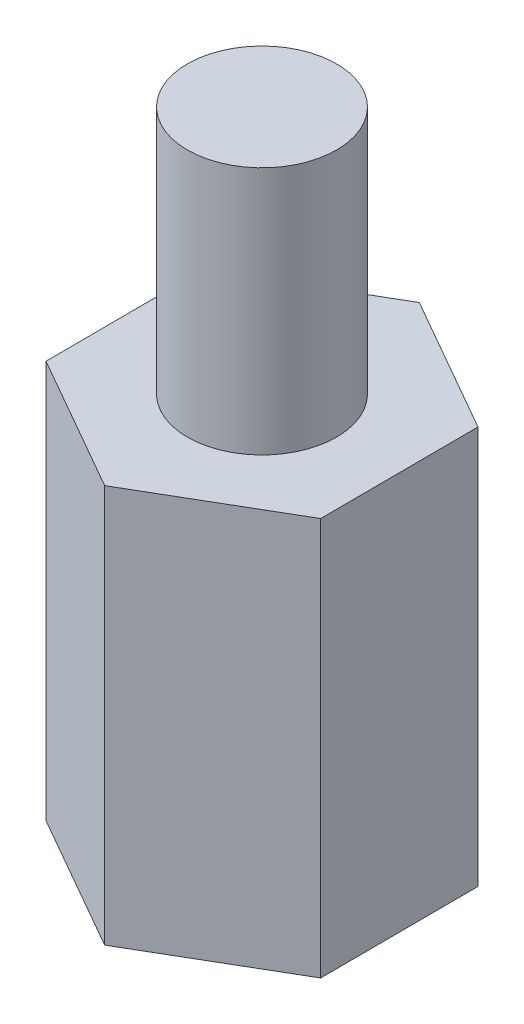
from build123d import *

# Parameters (mm, degrees)
SALIENTE_EXTRUIR1_DEPTH = 8
CROQUIS2_R              = 1.5
SALIENTE_EXTRUIR2_DEPTH = 5


with BuildPart() as part:
    # Croquis1 → Saliente-Extruir1 (new body)
    with BuildSketch(Plane(origin=(0, 0, 0), x_dir=(1, 0, 0), z_dir=(0, 1, 0))):
        Polygon((2.743476652, 1.598958785), (-0.013000601, 3.175399867), (-2.756477253, 1.576441083), (-2.743476652, -1.598958785), (0.013000601, -3.175399867), (2.756477253, -1.576441083), align=None)
    extrude(amount=SALIENTE_EXTRUIR1_DEPTH)

    # Croquis2 → Saliente-Extruir2 (add)
    with BuildSketch(Plane(origin=(0, 8, 0), x_dir=(1, 0, 0), z_dir=(0, 1, 0))):
        with Locations(Location((0, 0, 0), (0, 0, 270))):
            Circle(CROQUIS2_R)
    extrude(amount=SALIENTE_EXTRUIR2_DEPTH)


solid = part.part
